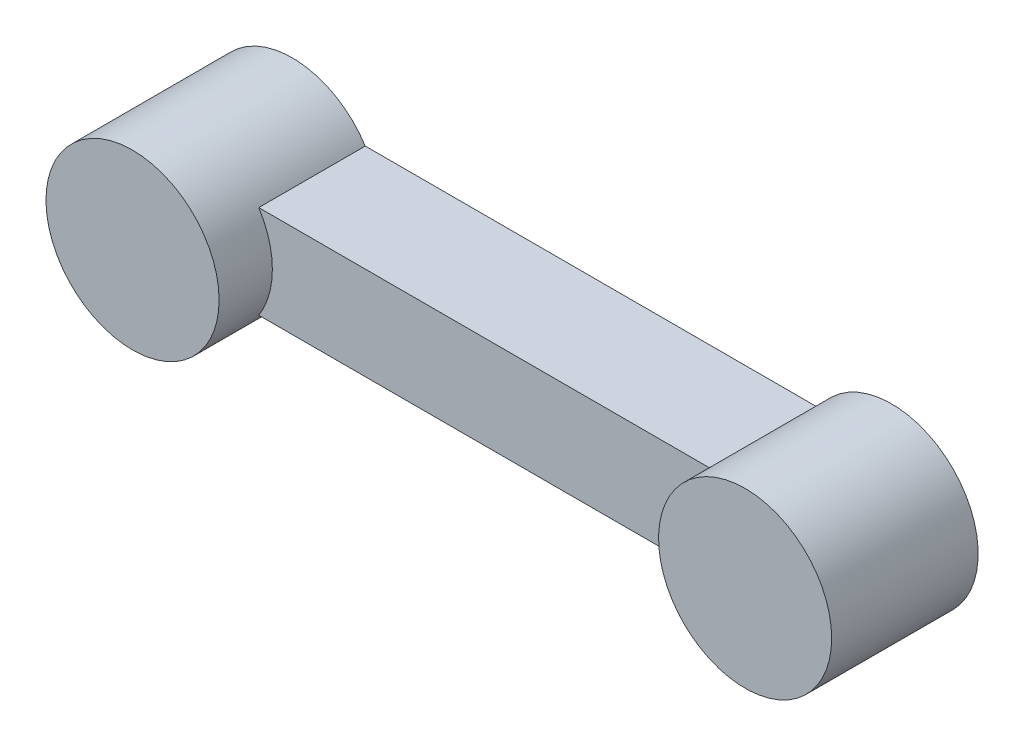
from build123d import *

# Parameters (mm, degrees)
SKETCH_3_W    = 90
SKETCH_3_H    = 14
BAR_DEPTH     = 16
SKETCH_4_R    = 13
ROOTHUB_DEPTH = 24
SKETCH_5_R    = 13
ENDHUB_DEPTH  = 22


with BuildPart() as part:
    # 草图3 → Bar (new body)
    with BuildSketch(Plane.XY):
        with Locations((65, 12)):
            Rectangle(SKETCH_3_W, SKETCH_3_H)
    extrude(amount=BAR_DEPTH)

    # 草图4 → RootHub (add)
    with BuildSketch(Plane.XY):
        with Locations(Location((20, 12, 0), (0, 0, 327.421029607))):
            Circle(SKETCH_4_R)
    extrude(amount=ROOTHUB_DEPTH)

    # 草图5 → EndHub (add)
    with BuildSketch(Plane.XY):
        with Locations(Location((110, 12, 0), (0, 0, 212.578970393))):
            Circle(SKETCH_5_R)
    extrude(amount=ENDHUB_DEPTH)


solid = part.part
